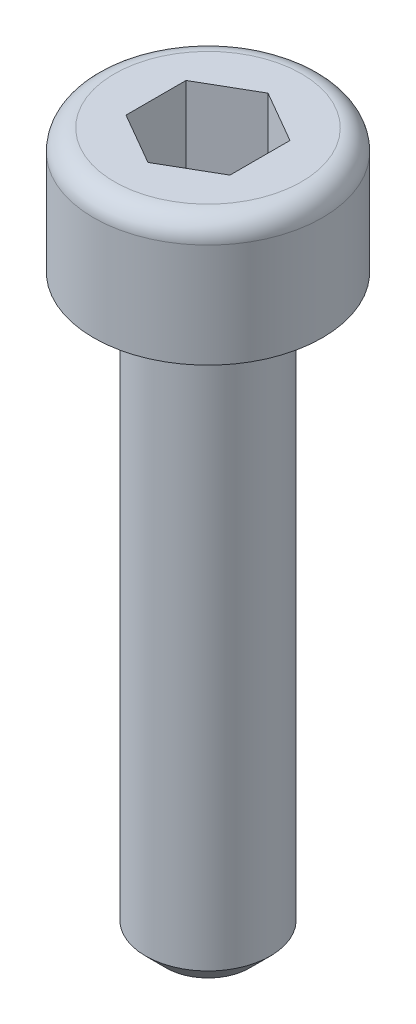
from build123d import *

# Parameters (mm, degrees)
CORTAR_EXTRUIR1_DEPTH = 2
CHAFL_N1_SIZE         = 0.5
REDONDEO1_R           = 0.5


with BuildPart() as part:
    # Croquis1 → Revolución1 (revolve)
    with BuildSketch(Plane.XY, mode=Mode.PRIVATE) as revoluci_n1_sk:
        Polygon((0, 0), (2.75, 0), (2.75, -3), (1.5, -3), (1.5, -17), (0, -17), align=None)
    revolve(revoluci_n1_sk.sketch.rotate(Axis((0, 0, 0), (0, -1, 0)), 90), axis=Axis((0, 0, 0), (0, -1, 0)))

    # Croquis2 → Cortar-Extruir1 (cut)
    with BuildSketch(Plane(origin=(0, 0, 0), x_dir=(1, 0, 0), z_dir=(0, 1, 0))):
        Polygon((1.25, 0.721687836), (0, 1.443375673), (-1.25, 0.721687836), (-1.25, -0.721687836), (0, -1.443375673), (1.25, -0.721687836), align=None)
    extrude(amount=-CORTAR_EXTRUIR1_DEPTH, mode=Mode.SUBTRACT)

    # Chaflán1
    chafl_n1_edges = [part.edges().sort_by_distance(p)[0] for p in [
        (0, -17, -1.5),
    ]]
    chamfer(chafl_n1_edges, length=CHAFL_N1_SIZE)

    # Redondeo1
    redondeo1_edges = [part.edges().sort_by_distance(p)[0] for p in [
        (0, 0, -2.75),
    ]]
    fillet(redondeo1_edges, radius=REDONDEO1_R)


solid = part.part
